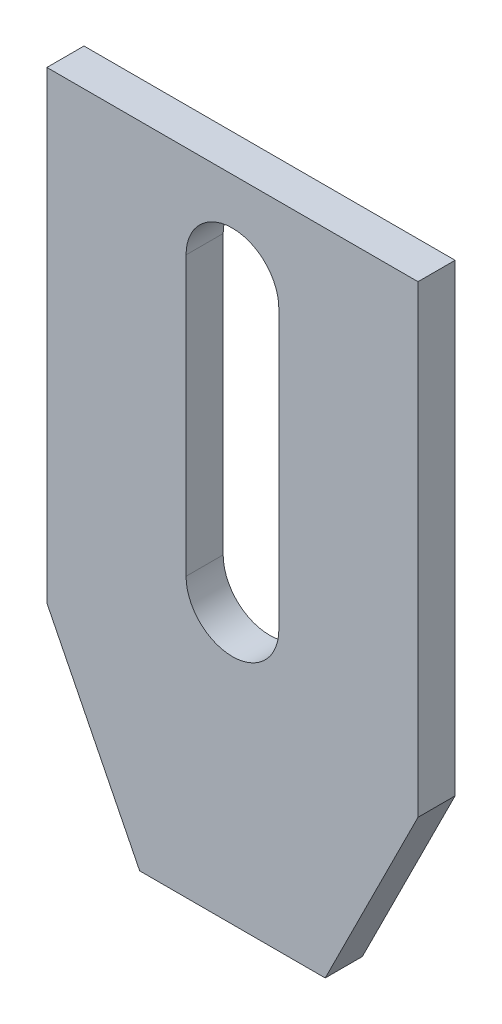
from build123d import *

# Parameters (mm, degrees)
BOSS_EXTRUDE1_DEPTH = 4


with BuildPart() as part:
    # Sketch1 → Boss-Extrude1 (new body)
    with BuildSketch(Plane.XY):
        Polygon((17.947368421, 44.210526316), (-22.052631579, 44.210526316), (-22.052631579, -5.789473684), (-12.052631579, -25.789473684), (7.947368421, -25.789473684), (17.947368421, -5.789473684), align=None)
        with BuildLine():
            Line((2.947368421, 34.210526316), (2.947368421, 4.210526316))
            ThreePointArc((2.947368421, 4.210526316), (-2.052631579, -0.789473684), (-7.052631579, 4.210526316))
            Line((-7.052631579, 4.210526316), (-7.052631579, 34.210526316))
            ThreePointArc((-7.052631579, 34.210526316), (-2.052631579, 39.210526316), (2.947368421, 34.210526316))
        make_face(mode=Mode.SUBTRACT)
    extrude(amount=BOSS_EXTRUDE1_DEPTH)


solid = part.part
